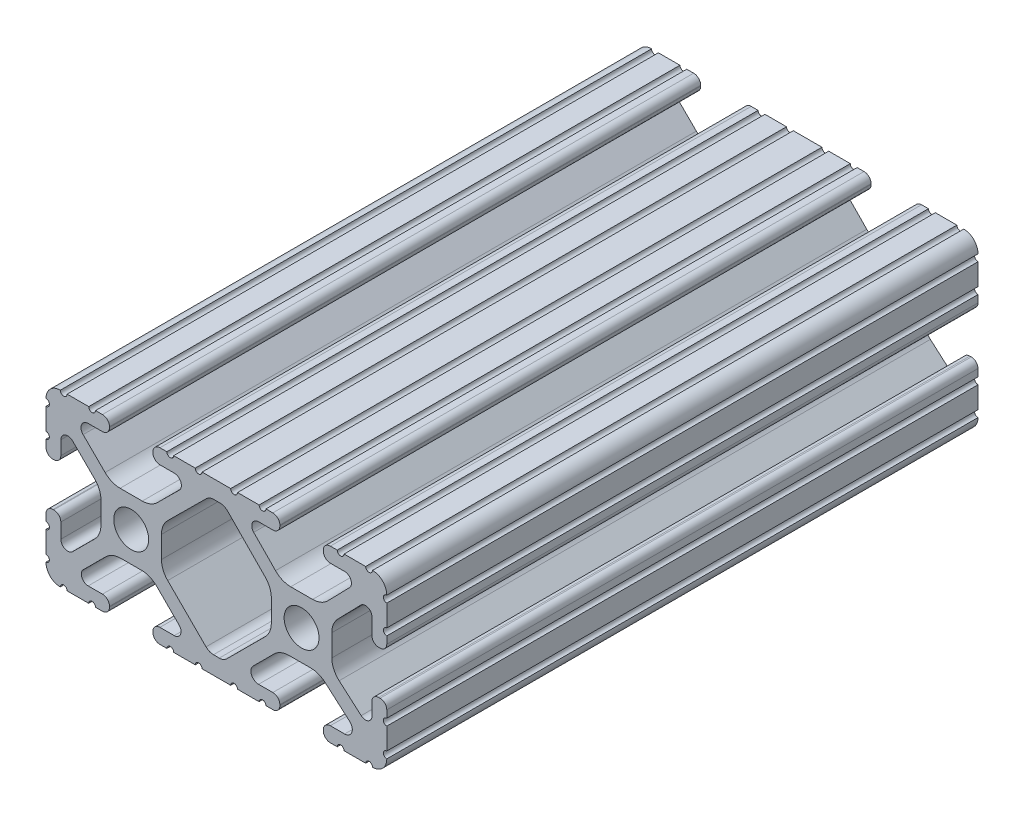
from build123d import *

# Parameters (mm, degrees)
SKETCH1_R           = 2.6035
BOSS_EXTRUDE1_DEPTH = 88.138


with BuildPart() as part:
    # Sketch1 → Boss-Extrude1 (new body)
    with BuildSketch(Plane.XY):
        with BuildLine():
            Line((18.01710265, 12.7), (16.98745015, 12.7))
            ThreePointArc((16.98745015, 12.7), (16.245730386, 12.392769614), (15.9385, 11.65104985))
            Line((15.9385, 11.65104985), (15.9385, 11.53922))
            ThreePointArc((15.9385, 11.53922), (16.245750844, 10.797450844), (16.98752, 10.4902))
            Line((16.98752, 10.4902), (19.116384363, 10.4902))
            ThreePointArc((19.116384363, 10.4902), (20.052502933, 9.869096983), (19.844087081, 8.765172272))
            Line((19.844087081, 8.765172272), (16.618993479, 5.455112286))
            ThreePointArc((16.618993479, 5.455112286), (15.578994274, 4.745442459), (14.344932584, 4.4958))
            Line((14.344932584, 4.4958), (11.083317835, 4.4958))
            ThreePointArc((11.083317835, 4.4958), (9.854330953, 4.743306833), (8.816955189, 5.447238587))
            Line((8.816955189, 5.447238587), (5.564154119, 8.762652677))
            ThreePointArc((5.564154119, 8.762652677), (5.352591412, 9.867473037), (6.289393385, 10.4902))
            Line((6.289393385, 10.4902), (8.41248, 10.4902))
            ThreePointArc((8.41248, 10.4902), (9.154249156, 10.797450844), (9.4615, 11.53922))
            Line((9.4615, 11.53922), (9.4615, 11.65104985))
            ThreePointArc((9.4615, 11.65104985), (9.154269614, 12.392769614), (8.41254985, 12.7))
            Line((8.41254985, 12.7), (7.38288465, 12.7))
            ThreePointArc((7.38288465, 12.7), (6.87488465, 12.192), (6.36688465, 12.7))
            Line((6.36688465, 12.7), (3.14958095, 12.7))
            ThreePointArc((3.14958095, 12.7), (2.64158095, 12.192), (2.13358095, 12.7))
            Line((2.13358095, 12.7), (-2.13358095, 12.7))
            ThreePointArc((-2.13358095, 12.7), (-2.64158095, 12.192), (-3.14958095, 12.7))
            Line((-3.14958095, 12.7), (-6.36689735, 12.7))
            ThreePointArc((-6.36689735, 12.7), (-6.87489735, 12.192), (-7.38289735, 12.7))
            Line((-7.38289735, 12.7), (-8.41254985, 12.7))
            ThreePointArc((-8.41254985, 12.7), (-9.154269614, 12.392769614), (-9.4615, 11.65104985))
            Line((-9.4615, 11.65104985), (-9.4615, 11.53922))
            ThreePointArc((-9.4615, 11.53922), (-9.154249156, 10.797450844), (-8.41248, 10.4902))
            Line((-8.41248, 10.4902), (-6.283641037, 10.4902))
            ThreePointArc((-6.283641037, 10.4902), (-5.297291557, 9.829633109), (-5.532576693, 8.666071843))
            Line((-5.532576693, 8.666071843), (-8.809985098, 5.416263103))
            ThreePointArc((-8.809985098, 5.416263103), (-9.836720513, 4.734920264), (-11.045536121, 4.4958))
            Line((-11.045536121, 4.4958), (-14.354463879, 4.4958))
            ThreePointArc((-14.354463879, 4.4958), (-15.563279487, 4.734920264), (-16.590014902, 5.416263103))
            Line((-16.590014902, 5.416263103), (-19.867423307, 8.666071843))
            ThreePointArc((-19.867423307, 8.666071843), (-20.102708443, 9.829633109), (-19.116358963, 10.4902))
            Line((-19.116358963, 10.4902), (-16.98752, 10.4902))
            ThreePointArc((-16.98752, 10.4902), (-16.245750844, 10.797450844), (-15.9385, 11.53922))
            Line((-15.9385, 11.53922), (-15.9385, 11.65104985))
            ThreePointArc((-15.9385, 11.65104985), (-16.245730386, 12.392769614), (-16.98745015, 12.7))
            Line((-16.98745015, 12.7), (-18.01711535, 12.7))
            ThreePointArc((-18.01711535, 12.7), (-18.52511535, 12.192), (-19.03311535, 12.7))
            Line((-19.03311535, 12.7), (-22.2504, 12.7))
            ThreePointArc((-22.2504, 12.7), (-22.758323491, 12.192000006), (-23.266399977, 12.699846982))
            ThreePointArc((-23.266399977, 12.699846982), (-24.782522516, 12.082522516), (-25.399846982, 10.566399977))
            ThreePointArc((-25.399846982, 10.566399977), (-24.892000006, 10.058323491), (-25.4, 9.5504))
            Line((-25.4, 9.5504), (-25.4, 6.3330836))
            ThreePointArc((-25.4, 6.3330836), (-24.892, 5.8250836), (-25.4, 5.3170836))
            Line((-25.4, 5.3170836), (-25.4, 4.237520184))
            ThreePointArc((-25.4, 4.237520184), (-25.107393763, 3.531106237), (-24.400979816, 3.2385))
            Line((-24.400979816, 3.2385), (-24.23922, 3.2385))
            ThreePointArc((-24.23922, 3.2385), (-23.497450844, 3.545750844), (-23.1902, 4.28752))
            Line((-23.1902, 4.28752), (-23.1902, 6.334741132))
            ThreePointArc((-23.1902, 6.334741132), (-22.556026952, 7.286023527), (-21.434002553, 7.066535717))
            Line((-21.434002553, 7.066535717), (-18.147950853, 3.808156468))
            ThreePointArc((-18.147950853, 3.808156468), (-17.452759693, 2.774838327), (-17.208501877, 1.553619571))
            Line((-17.208501877, 1.553619571), (-17.208501877, -1.695179196))
            ThreePointArc((-17.208501877, -1.695179196), (-17.450738657, -2.911536421), (-18.140486065, -3.942289578))
            Line((-18.140486065, -3.942289578), (-21.431579576, -7.227386226))
            ThreePointArc((-21.431579576, -7.227386226), (-22.55444896, -7.449940594), (-23.1902, -6.498002195))
            Line((-23.1902, -6.498002195), (-23.1902, -4.28752))
            ThreePointArc((-23.1902, -4.28752), (-23.497450844, -3.545750844), (-24.23922, -3.2385))
            Line((-24.23922, -3.2385), (-24.35098, -3.2385))
            ThreePointArc((-24.35098, -3.2385), (-25.092749156, -3.545750844), (-25.4, -4.28752))
            Line((-25.4, -4.28752), (-25.4, -5.3171344))
            ThreePointArc((-25.4, -5.3171344), (-24.892, -5.8251344), (-25.4, -6.3331344))
            Line((-25.4, -6.3331344), (-25.4, -9.5504))
            ThreePointArc((-25.4, -9.5504), (-24.892000006, -10.058323491), (-25.399846982, -10.566399977))
            ThreePointArc((-25.399846982, -10.566399977), (-24.782522516, -12.082522516), (-23.266399977, -12.699846982))
            ThreePointArc((-23.266399977, -12.699846982), (-22.758323491, -12.192000006), (-22.2504, -12.7))
            Line((-22.2504, -12.7), (-19.03308995, -12.7))
            ThreePointArc((-19.03308995, -12.7), (-18.52508995, -12.192), (-18.01708995, -12.7))
            Line((-18.01708995, -12.7), (-16.9874692, -12.7))
            ThreePointArc((-16.9874692, -12.7), (-16.245700044, -12.392749156), (-15.9384492, -11.65098))
            Line((-15.9384492, -11.65098), (-15.9384492, -11.53922))
            ThreePointArc((-15.9384492, -11.53922), (-16.245700044, -10.797450844), (-16.9874692, -10.4902))
            Line((-16.9874692, -10.4902), (-19.116358963, -10.4902))
            ThreePointArc((-19.116358963, -10.4902), (-20.055197748, -9.862578342), (-19.834124023, -8.755124678))
            Line((-19.834124023, -8.755124678), (-16.49660751, -5.423689618))
            ThreePointArc((-16.49660751, -5.423689618), (-15.467274017, -4.736928798), (-14.253591699, -4.4958))
            Line((-14.253591699, -4.4958), (-11.146408301, -4.4958))
            ThreePointArc((-11.146408301, -4.4958), (-9.932725983, -4.736928798), (-8.90339249, -5.423689618))
            Line((-8.90339249, -5.423689618), (-5.565875977, -8.755124678))
            ThreePointArc((-5.565875977, -8.755124678), (-5.344802252, -9.862578342), (-6.283641037, -10.4902))
            Line((-6.283641037, -10.4902), (-8.4125308, -10.4902))
            ThreePointArc((-8.4125308, -10.4902), (-9.154299956, -10.797450844), (-9.4615508, -11.53922))
            Line((-9.4615508, -11.53922), (-9.4615508, -11.65098))
            ThreePointArc((-9.4615508, -11.65098), (-9.154299956, -12.392749156), (-8.4125308, -12.7))
            Line((-8.4125308, -12.7), (-7.38287195, -12.7))
            ThreePointArc((-7.38287195, -12.7), (-6.87487195, -12.192), (-6.36687195, -12.7))
            Line((-6.36687195, -12.7), (-3.14960635, -12.7))
            ThreePointArc((-3.14960635, -12.7), (-2.64160635, -12.192), (-2.13360635, -12.7))
            Line((-2.13360635, -12.7), (2.13360635, -12.7))
            ThreePointArc((2.13360635, -12.7), (2.64159365, -12.1920127), (3.14958095, -12.7))
            Line((3.14958095, -12.7), (6.36691005, -12.7))
            ThreePointArc((6.36691005, -12.7), (6.87491005, -12.192), (7.38291005, -12.7))
            Line((7.38291005, -12.7), (8.4125308, -12.7))
            ThreePointArc((8.4125308, -12.7), (9.154299956, -12.392749156), (9.4615508, -11.65098))
            Line((9.4615508, -11.65098), (9.4615508, -11.53922))
            ThreePointArc((9.4615508, -11.53922), (9.154299956, -10.797450844), (8.4125308, -10.4902))
            Line((8.4125308, -10.4902), (6.289393385, -10.4902))
            ThreePointArc((6.289393385, -10.4902), (5.231590322, -9.783049717), (5.480677245, -8.535265862))
            Line((5.480677245, -8.535265862), (8.597933595, -5.423689618))
            ThreePointArc((8.597933595, -5.423689618), (9.627267088, -4.736928798), (10.840949406, -4.4958))
            Line((10.840949406, -4.4958), (14.102564155, -4.4958))
            ThreePointArc((14.102564155, -4.4958), (15.215927525, -4.697410182), (16.187895372, -5.276636531))
            Line((16.187895372, -5.276636531), (19.868247549, -8.482246082))
            ThreePointArc((19.868247549, -8.482246082), (20.188435806, -9.746879864), (19.116384363, -10.4902))
            Line((19.116384363, -10.4902), (16.9874692, -10.4902))
            ThreePointArc((16.9874692, -10.4902), (16.245700044, -10.797450844), (15.9384492, -11.53922))
            Line((15.9384492, -11.53922), (15.9384492, -11.65098))
            ThreePointArc((15.9384492, -11.65098), (16.245700044, -12.392749156), (16.9874692, -12.7))
            Line((16.9874692, -12.7), (18.01710265, -12.7))
            ThreePointArc((18.01710265, -12.7), (18.52510265, -12.192), (19.03310265, -12.7))
            Line((19.03310265, -12.7), (22.2504, -12.7))
            ThreePointArc((22.2504, -12.7), (22.758323491, -12.192000006), (23.266399977, -12.699846982))
            ThreePointArc((23.266399977, -12.699846982), (24.782522516, -12.082522516), (25.399846982, -10.566399977))
            ThreePointArc((25.399846982, -10.566399977), (24.892000006, -10.058323492), (25.4, -9.550400001))
            Line((25.4, -9.550400001), (25.4, -6.333083592))
            ThreePointArc((25.4, -6.333083592), (24.892000001, -5.825083593), (25.4, -5.317083593))
            Line((25.4, -5.317083593), (25.4, -4.237520184))
            ThreePointArc((25.4, -4.237520184), (25.107393763, -3.531106237), (24.400979816, -3.2385))
            Line((24.400979816, -3.2385), (24.189220184, -3.2385))
            ThreePointArc((24.189220184, -3.2385), (23.482806237, -3.531106237), (23.1902, -4.237520184))
            Line((23.1902, -4.237520184), (23.1902, -6.155876159))
            ThreePointArc((23.1902, -6.155876159), (22.62232736, -7.038258539), (21.583974541, -6.886926384))
            Line((21.583974541, -6.886926384), (18.29817066, -4.024970844))
            ThreePointArc((18.29817066, -4.024970844), (17.493730985, -2.946044689), (17.208501877, -1.630807374))
            Line((17.208501877, -1.630807374), (17.208501877, 1.630807374))
            ThreePointArc((17.208501877, 1.630807374), (17.442348332, 2.82673414), (18.109440981, 3.846495088))
            Line((18.109440981, 3.846495088), (21.526346532, 7.353420386))
            ThreePointArc((21.526346532, 7.353420386), (22.585896263, 7.574939077), (23.1902, 6.676867167))
            Line((23.1902, 6.676867167), (23.1902, 4.237520184))
            ThreePointArc((23.1902, 4.237520184), (23.482806237, 3.531106237), (24.189220184, 3.2385))
            Line((24.189220184, 3.2385), (24.400979816, 3.2385))
            ThreePointArc((24.400979816, 3.2385), (25.107393763, 3.531106237), (25.4, 4.237520184))
            Line((25.4, 4.237520184), (25.4, 5.3170836))
            ThreePointArc((25.4, 5.3170836), (24.891949193, 5.825134407), (25.4, 6.333185215))
            Line((25.4, 6.333185215), (25.4, 9.550400015))
            ThreePointArc((25.4, 9.550400015), (24.892000013, 10.058323498), (25.399846982, 10.566399977))
            ThreePointArc((25.399846982, 10.566399977), (24.782522516, 12.082522516), (23.266399977, 12.699846982))
            ThreePointArc((23.266399977, 12.699846982), (22.758323491, 12.192000006), (22.2504, 12.7))
            Line((22.2504, 12.7), (19.03310265, 12.7))
            ThreePointArc((19.03310265, 12.7), (18.52510265, 12.192), (18.01710265, 12.7))
        make_face()
        with Locations((-12.7, 0)):
            Circle(SKETCH1_R, mode=Mode.SUBTRACT)
        with Locations((12.7, 0)):
            Circle(SKETCH1_R, mode=Mode.SUBTRACT)
        with BuildLine():
            Line((-7.259513935, -3.869413038), (-1.545748891, -9.572766749))
            ThreePointArc((-1.545748891, -9.572766749), (-1.035199478, -9.913400116), (-0.433213048, -10.033))
            Line((-0.433213048, -10.033), (0.433213048, -10.033))
            ThreePointArc((0.433213048, -10.033), (1.035199478, -9.913400116), (1.545748891, -9.572766749))
            Line((1.545748891, -9.572766749), (7.259513935, -3.869413038))
            ThreePointArc((7.259513935, -3.869413038), (7.949261343, -2.838659881), (8.191498123, -1.622302656))
            Line((8.191498123, -1.622302656), (8.191498123, 1.622302656))
            ThreePointArc((8.191498123, 1.622302656), (7.955573352, 2.823327967), (7.282860769, 3.845864069))
            Line((7.282860769, 3.845864069), (1.675572808, 9.561086461))
            ThreePointArc((1.675572808, 9.561086461), (1.161034429, 9.910236611), (0.551456936, 10.033))
            Line((0.551456936, 10.033), (-0.395199982, 10.033))
            ThreePointArc((-0.395199982, 10.033), (-0.994772524, 9.914396349), (-1.50403329, 9.576450301))
            Line((-1.50403329, 9.576450301), (-7.252049147, 3.876839553))
            ThreePointArc((-7.252049147, 3.876839553), (-7.947240307, 2.843521412), (-8.191498123, 1.622302656))
            Line((-8.191498123, 1.622302656), (-8.191498123, -1.622302656))
            ThreePointArc((-8.191498123, -1.622302656), (-7.949261343, -2.838659881), (-7.259513935, -3.869413038))
        make_face(mode=Mode.SUBTRACT)
    extrude(amount=BOSS_EXTRUDE1_DEPTH)


solid = part.part
